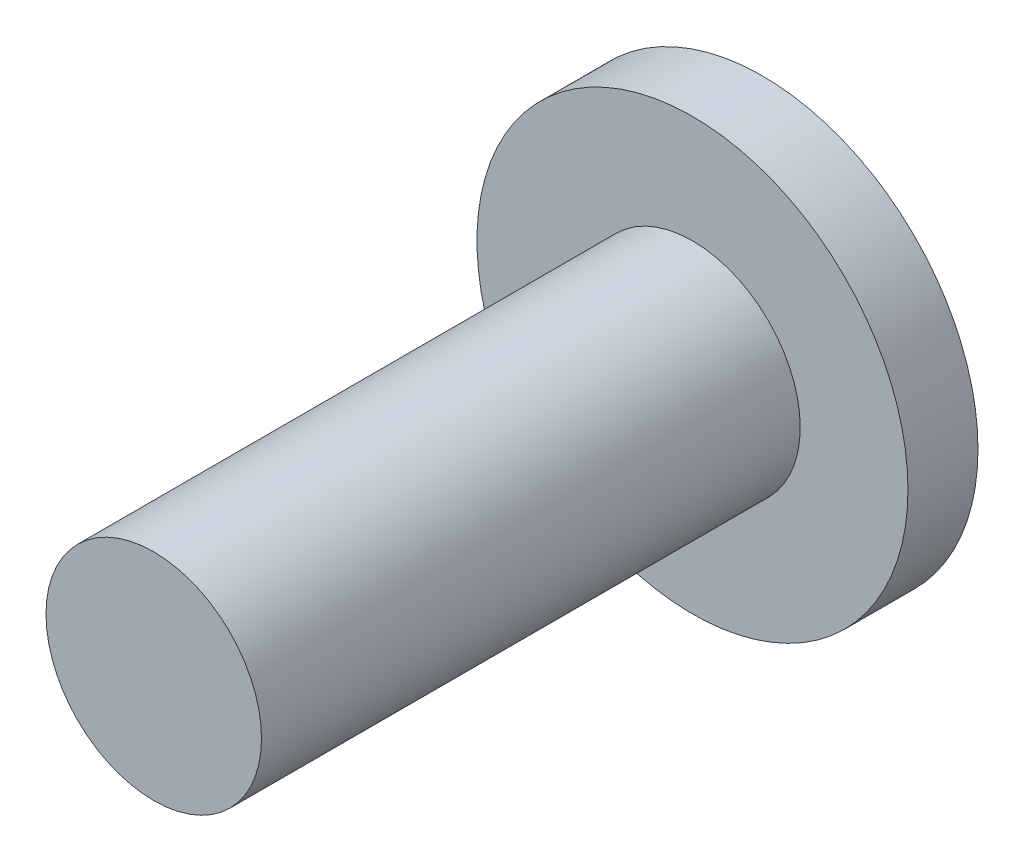
from build123d import *

# Parameters (mm, degrees)
SKETCH_1_R          = 4
EXTRUDE_1_DEPTH     = 1.3
SKETCH_2_R          = 2
EXTRUDE_2_DEPTH     = 10
CUT_EXTRUDE_1_DEPTH = 1


with BuildPart() as part:
    # 草图1 → 凸台-拉伸1 (new body)
    with BuildSketch(Plane.XY):
        Circle(SKETCH_1_R)
    extrude(amount=EXTRUDE_1_DEPTH)

    # 草图2 → 凸台-拉伸2 (add)
    with BuildSketch(Plane.XY.offset(1.3)):
        Circle(SKETCH_2_R)
    extrude(amount=EXTRUDE_2_DEPTH)

    # 草图3 → 切除-拉伸1 (cut)
    with BuildSketch(Plane(origin=(0, 0, 0), x_dir=(-1, 0, 0), z_dir=(0, 0, -1))):
        Polygon((1.443375673, 0), (0.721687836, 1.25), (-0.721687836, 1.25), (-1.443375673, 0), (-0.721687836, -1.25), (0.721687836, -1.25), align=None)
    extrude(amount=-CUT_EXTRUDE_1_DEPTH, mode=Mode.SUBTRACT)


solid = part.part
